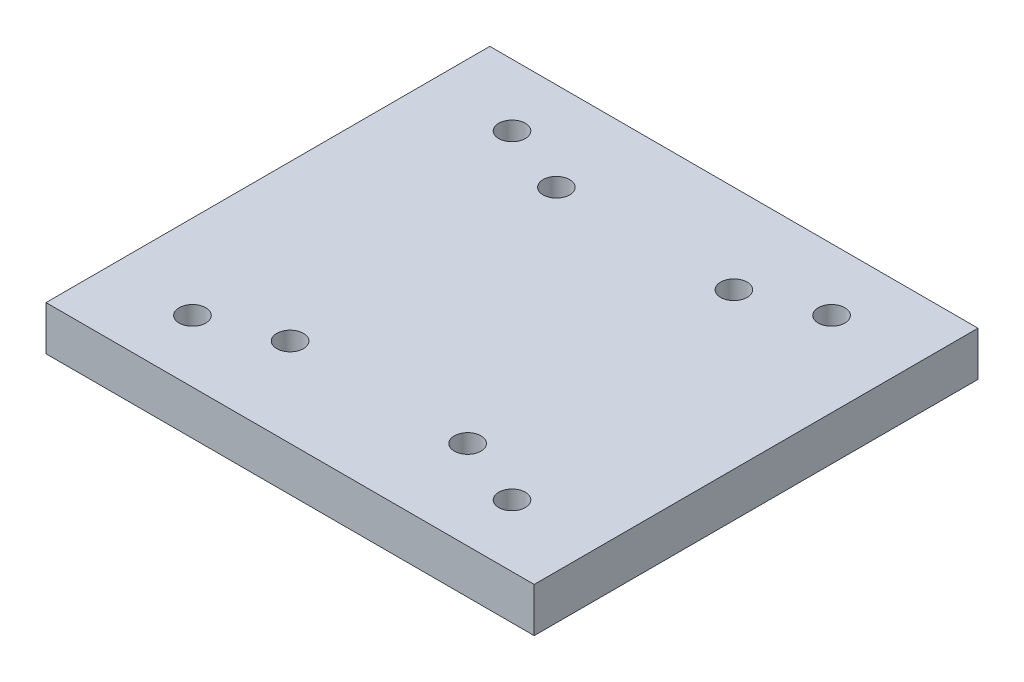
from build123d import *

# Parameters (mm, degrees)
SKETCH_1_W          = 55
SKETCH_1_H          = 50
EXTRUDE_1_DEPTH     = 5
SKETCH_2_R          = 1.5
CUT_EXTRUDE_1_DEPTH = 38.5
SKETCH_5_R          = 1.5
CUT_EXTRUDE_2_DEPTH = 10


with BuildPart() as part:
    # 草图1 → 凸台-拉伸1 (new body)
    with BuildSketch(Plane(origin=(0, 0, 0), x_dir=(1, 0, 0), z_dir=(0, 1, 0))):
        Rectangle(SKETCH_1_W, SKETCH_1_H)
    extrude(amount=EXTRUDE_1_DEPTH)

    # 草图2 → 切除-拉伸1 (cut, through all)
    with BuildSketch(Plane(origin=(0, 5, 0), x_dir=(1, 0, 0), z_dir=(0, 1, 0))):
        with Locations(Location((-18, 18, 0), (0, 0, 270))):
            Circle(SKETCH_2_R)
        with Locations(Location((18, 18, 0), (0, 0, 270))):
            Circle(SKETCH_2_R)
        with Locations(Location((18, -18, 0), (0, 0, 270))):
            Circle(SKETCH_2_R)
        with Locations(Location((-18, -18, 0), (0, 0, 270))):
            Circle(SKETCH_2_R)
    extrude(amount=-CUT_EXTRUDE_1_DEPTH, mode=Mode.SUBTRACT)

    # 草图5 → 切除-拉伸2 (cut)
    with BuildSketch(Plane(origin=(0, 5, 0), x_dir=(1, 0, 0), z_dir=(0, 1, 0))):
        with Locations(Location((-10, 15, 0), (0, 0, 270))):
            Circle(SKETCH_5_R)
        with Locations(Location((10, 15, 0), (0, 0, 270))):
            Circle(SKETCH_5_R)
        with Locations(Location((10, -15, 0), (0, 0, 270))):
            Circle(SKETCH_5_R)
        with Locations(Location((-10, -15, 0), (0, 0, 270))):
            Circle(SKETCH_5_R)
    extrude(amount=-CUT_EXTRUDE_2_DEPTH, mode=Mode.SUBTRACT)


solid = part.part
